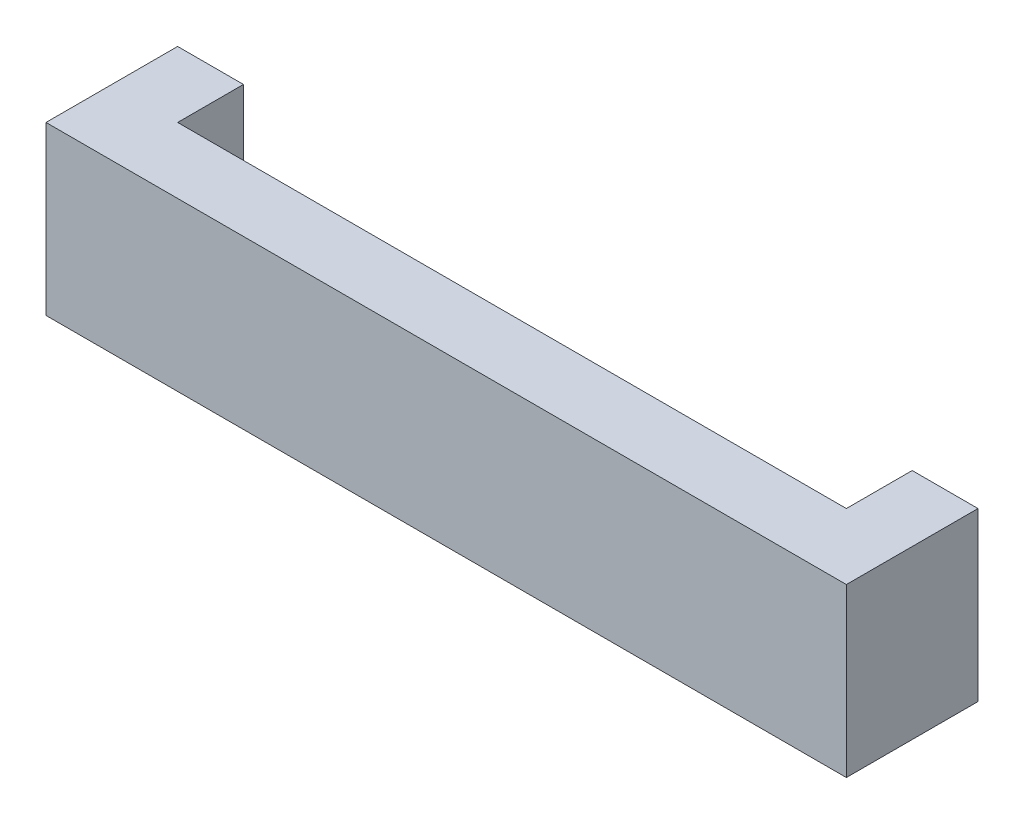
from build123d import *

# Parameters (mm, degrees)
BOSS_EXTRUDE1_DEPTH = 6.35


with BuildPart() as part:
    # Sketch1 → Boss-Extrude1 (new, symmetric)
    with BuildSketch(Plane(origin=(0, 0, 0), x_dir=(1, 0, 0), z_dir=(0, 1, 0))):
        Polygon((-30.4, 5), (-25.4, 5), (-25.4, 0), (25.4, 0), (25.4, 5), (30.4, 5), (30.4, -5), (-30.4, -5), align=None)
    extrude(amount=BOSS_EXTRUDE1_DEPTH, both=True)


solid = part.part
